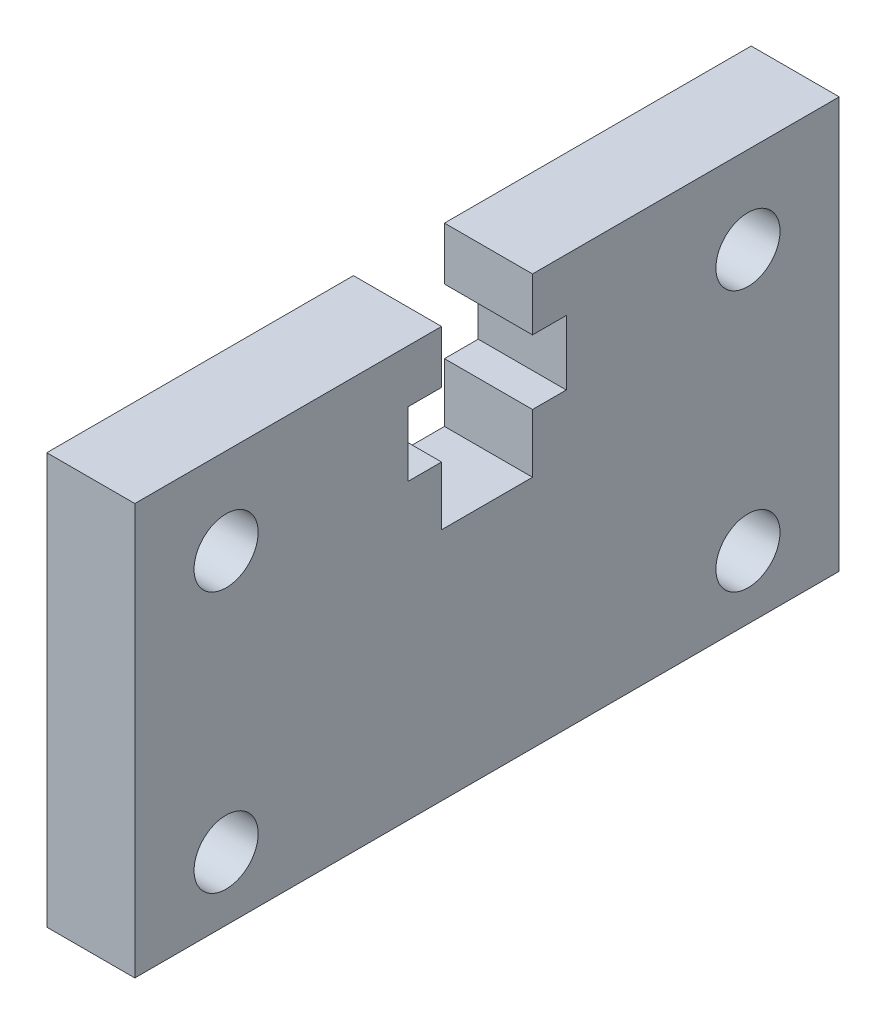
from build123d import *

# Parameters (mm, degrees)
SKETCH1_W                   = 24
SKETCH1_H                   = 14
BOSS_EXTRUDE1_DEPTH         = 3
F_44_0_086_DIAMETER_HOLE3_D = 2.1844
SKETCH6_W                   = 3.1
SKETCH6_H                   = 6
SKETCH6_W_2                 = 5.4
SKETCH6_H_2                 = 2.2
CUT_EXTRUDE1_DEPTH          = 3


with BuildPart() as part:
    # Sketch1 → Boss-Extrude1 (new body)
    with BuildSketch(Plane(origin=(0, 0, 0), x_dir=(0, 0, -1), z_dir=(1, 0, 0))):
        with Locations((12, 7)):
            Rectangle(SKETCH1_W, SKETCH1_H)
    extrude(amount=BOSS_EXTRUDE1_DEPTH)

    # #44 (0.086) Diameter Hole3 (through all)
    with Locations(Plane(origin=(3, 0, 0), x_dir=(0, 0, -1), z_dir=(1, 0, 0))):
        with Locations((3.11, 11.05), (20.889999972, 11.049), (20.889999944, 2.159), (3.11, 2.16)):
            Hole(F_44_0_086_DIAMETER_HOLE3_D / 2)

    # Sketch6 → Cut-Extrude1 (cut)
    with BuildSketch(Plane(origin=(3, 0, 0), x_dir=(0, 0, -1), z_dir=(1, 0, 0))):
        with Locations((12, 11)):
            Rectangle(SKETCH6_W, SKETCH6_H)
        with Locations((12, 11.1)):
            Rectangle(SKETCH6_W_2, SKETCH6_H_2)
    extrude(amount=-CUT_EXTRUDE1_DEPTH, mode=Mode.SUBTRACT)


solid = part.part
